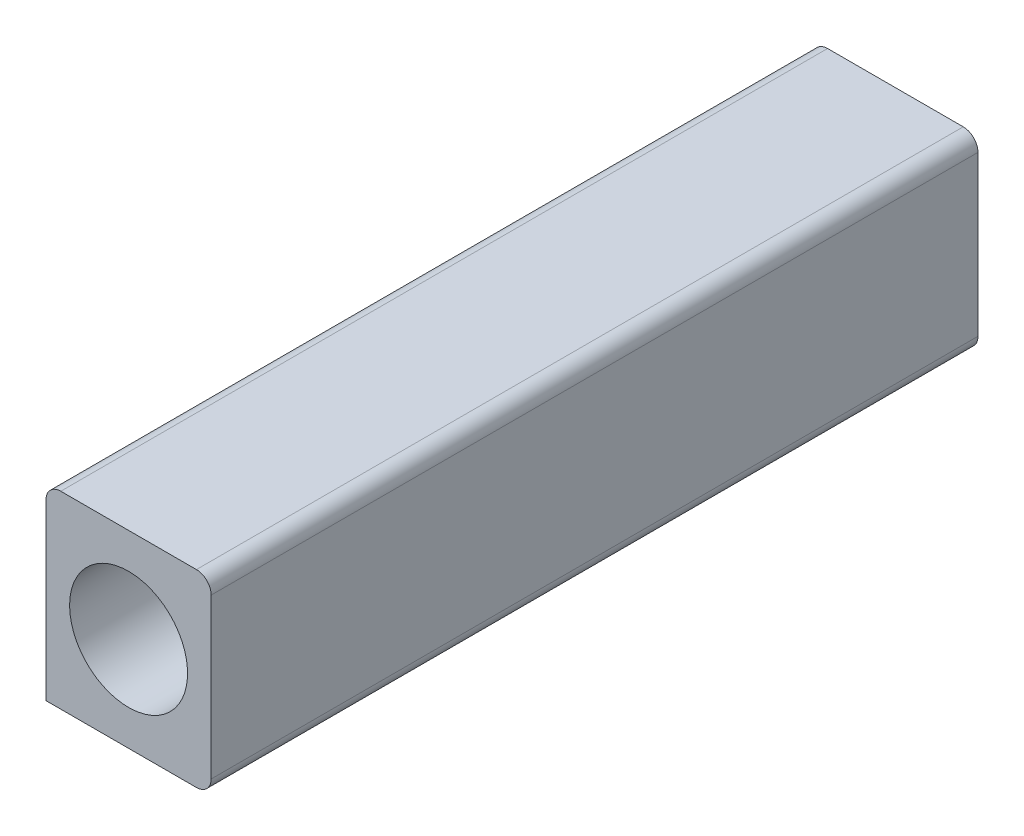
from build123d import *

# Parameters (mm, degrees)
SKETCH_8_W          = 56
SKETCH_8_H          = 64
EXTRUDE_1_DEPTH     = 260
SKETCH_9_R          = 20
CUT_EXTRUDE_1_DEPTH = 264.453980801
FILLET_1_R          = 5


with BuildPart() as part:
    # 草图8 → 凸台-拉伸1 (new body)
    with BuildSketch(Plane.XY):
        Rectangle(SKETCH_8_W, SKETCH_8_H)
    extrude(amount=EXTRUDE_1_DEPTH)

    # 草图9 → 切除-拉伸1 (cut, through all)
    with BuildSketch(Plane(origin=(0, 0, 0), x_dir=(-1, 0, 0), z_dir=(0, 0, -1))):
        Circle(SKETCH_9_R)
    extrude(amount=-CUT_EXTRUDE_1_DEPTH, mode=Mode.SUBTRACT)

    # 圆角1
    fillet_1_edges = [part.edges().sort_by_distance(p)[0] for p in [
        (-28, 32, 130),
        (28, 32, 130),
        (28, -32, 130),
    ]]
    fillet(fillet_1_edges, radius=FILLET_1_R)


solid = part.part
